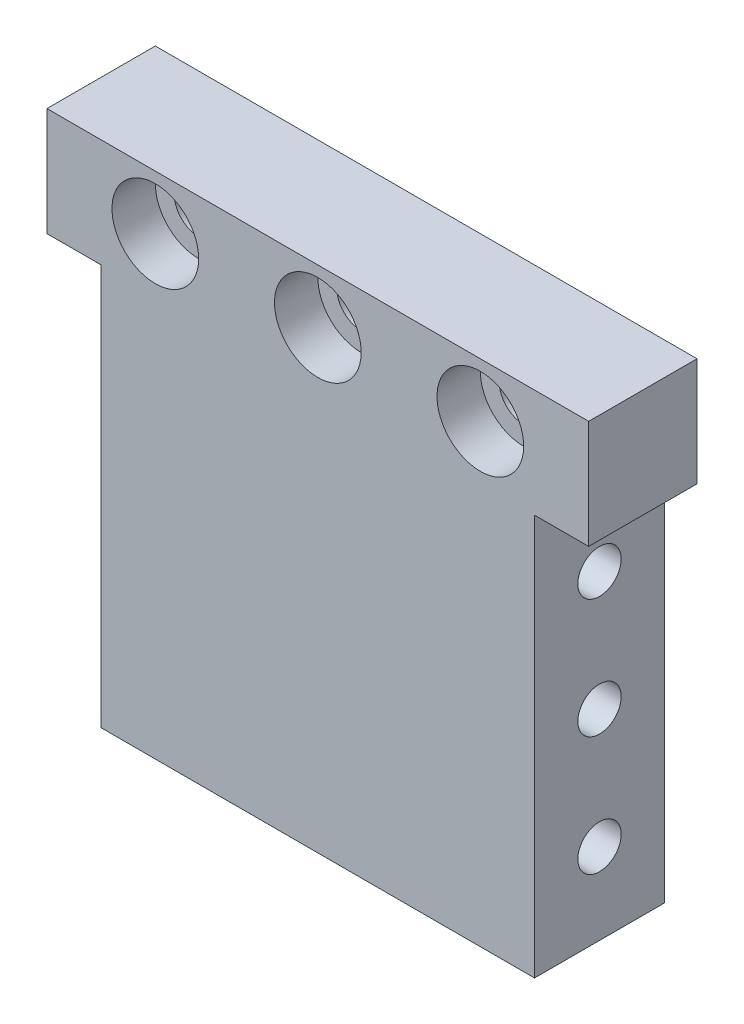
from build123d import *

# Parameters (mm, degrees)
SKETCH_1_W          = 50
SKETCH_1_H          = 47
EXTRUDE_1_DEPTH     = 12
SKETCH_2_W          = 50
SKETCH_2_H          = 10
CUT_EXTRUDE_1_DEPTH = 2
SKETCH_3_R          = 2.25
CUT_EXTRUDE_2_DEPTH = 70.663476801
SKETCH_4_W          = 5
SKETCH_4_H          = 37
CUT_EXTRUDE_3_DEPTH = 70.663476801
SKETCH_5_R          = 2
CUT_EXTRUDE_4_DEPTH = 10
CUT_EXTRUDE_START   = -10
SKETCH_6_R          = 2
CUT_EXTRUDE_5_DEPTH = 10
SKETCH_7_R          = 4
CUT_EXTRUDE_6_DEPTH = 4


with BuildPart() as part:
    # 스케치1 → 보스-돌출1 (new body)
    with BuildSketch(Plane.XY):
        with Locations((25, 23.5)):
            Rectangle(SKETCH_1_W, SKETCH_1_H)
    extrude(amount=EXTRUDE_1_DEPTH)

    # 스케치2 → 컷-돌출1 (cut)
    with BuildSketch(Plane(origin=(0, 0, 0), x_dir=(-1, 0, 0), z_dir=(0, 0, -1))):
        with Locations((-25, 42)):
            Rectangle(SKETCH_2_W, SKETCH_2_H)
    extrude(amount=-CUT_EXTRUDE_1_DEPTH, mode=Mode.SUBTRACT)

    # 스케치3 → 컷-돌출2 (cut, through all)
    with BuildSketch(Plane.XY.offset(12)):
        with Locations((25, 42)):
            Circle(SKETCH_3_R)
        with Locations((40, 42)):
            Circle(SKETCH_3_R)
        with Locations((10, 42)):
            Circle(SKETCH_3_R)
    extrude(amount=-CUT_EXTRUDE_2_DEPTH, mode=Mode.SUBTRACT)

    # 스케치4 → 컷-돌출3 (cut, through all)
    with BuildSketch(Plane.XY.offset(12)):
        with Locations((2.5, 18.5)):
            Rectangle(SKETCH_4_W, SKETCH_4_H)
        with Locations((47.5, 18.5)):
            Rectangle(SKETCH_4_W, SKETCH_4_H)
    extrude(amount=-CUT_EXTRUDE_3_DEPTH, mode=Mode.SUBTRACT)

    # 스케치5 → 컷-돌출4 (cut)
    with BuildSketch(Plane(origin=(45, 0, 0), x_dir=(0, 0, -1), z_dir=(1, 0, 0))):
        with Locations((-6, 29.5)):
            Circle(SKETCH_5_R)
        with Locations((-6, 18.5)):
            Circle(SKETCH_5_R)
        with Locations((-6, 7.5)):
            Circle(SKETCH_5_R)
    extrude(amount=-CUT_EXTRUDE_4_DEPTH, mode=Mode.SUBTRACT)

    # 스케치6 → 컷-돌출5 (cut)
    with BuildSketch(Plane.ZY.offset(-5).offset(CUT_EXTRUDE_START)):
        with Locations(Location((6, 29.5, 0), (0, 0, 180))):
            Circle(SKETCH_6_R)
        with Locations(Location((6, 18.5, 0), (0, 0, 180))):
            Circle(SKETCH_6_R)
        with Locations(Location((6, 7.5, 0), (0, 0, 180))):
            Circle(SKETCH_6_R)
    extrude(amount=CUT_EXTRUDE_5_DEPTH, mode=Mode.SUBTRACT)

    # 스케치7 → 컷-돌출6 (cut)
    with BuildSketch(Plane.XY.offset(12)):
        with Locations((10, 42)):
            Circle(SKETCH_7_R)
        with Locations((25, 42)):
            Circle(SKETCH_7_R)
        with Locations((40, 42)):
            Circle(SKETCH_7_R)
    extrude(amount=-CUT_EXTRUDE_6_DEPTH, mode=Mode.SUBTRACT)


solid = part.part
